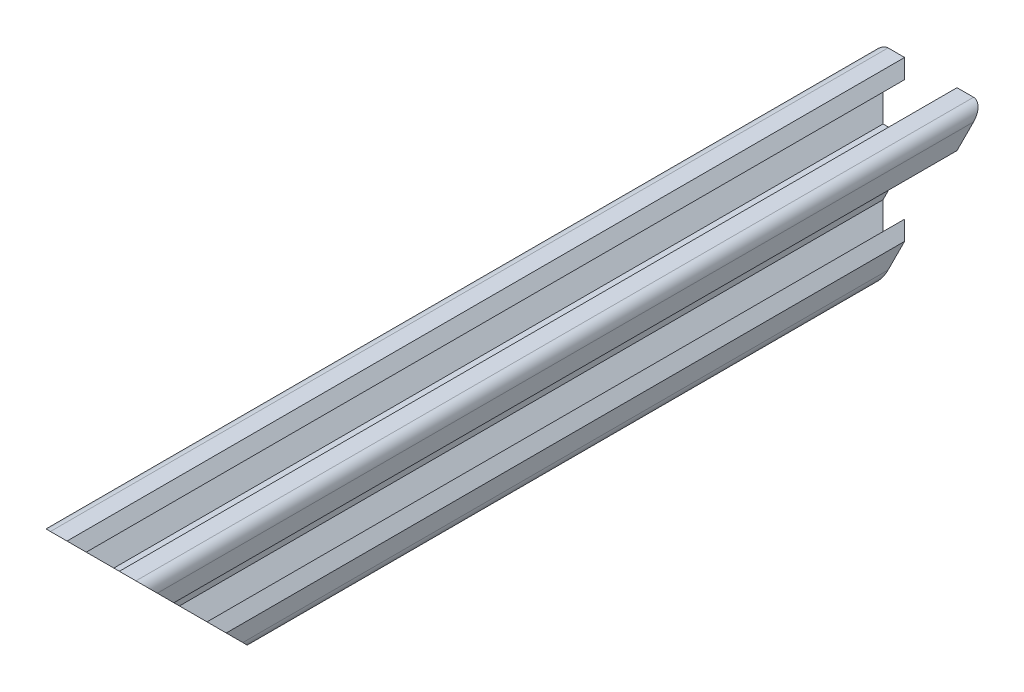
from build123d import *

# Parameters (mm, degrees)
SKETCH1_R           = 2.1
BOSS_EXTRUDE1_DEPTH = 156.74
CUT_EXTRUDE1_DEPTH  = 159.326964223


with BuildPart() as part:
    # Sketch1 → Boss-Extrude1 (new body)
    with BuildSketch(Plane.XY):
        with BuildLine():
            Line((-4.9, -10), (-3.1, -8.2))
            Line((-3.1, -8.2), (-5.5, -8.2))
            Line((-5.5, -8.2), (-5.5, -6.560660172))
            Line((-5.5, -6.560660172), (-2.539339828, -3.6))
            Line((-2.539339828, -3.6), (2.539339828, -3.6))
            Line((2.539339828, -3.6), (5.5, -6.560660172))
            Line((5.5, -6.560660172), (5.5, -8.2))
            Line((5.5, -8.2), (3.1, -8.2))
            Line((3.1, -8.2), (4.9, -10))
            Line((4.9, -10), (8, -10))
            ThreePointArc((8, -10), (9.414213562, -9.414213562), (10, -8))
            Line((10, -8), (10, -4.9))
            Line((10, -4.9), (8.2, -3.1))
            Line((8.2, -3.1), (8.2, -5.5))
            Line((8.2, -5.5), (6.560660172, -5.5))
            Line((6.560660172, -5.5), (3.6, -2.539339828))
            Line((3.6, -2.539339828), (3.6, 2.539339828))
            Line((3.6, 2.539339828), (6.560660172, 5.5))
            Line((6.560660172, 5.5), (8.2, 5.5))
            Line((8.2, 5.5), (8.2, 3.1))
            Line((8.2, 3.1), (10, 4.9))
            Line((10, 4.9), (10, 8))
            ThreePointArc((10, 8), (9.414213562, 9.414213562), (8, 10))
            Line((8, 10), (4.9, 10))
            Line((4.9, 10), (3.1, 8.2))
            Line((3.1, 8.2), (5.5, 8.2))
            Line((5.5, 8.2), (5.5, 6.560660172))
            Line((5.5, 6.560660172), (2.539339828, 3.6))
            Line((2.539339828, 3.6), (-2.539339828, 3.6))
            Line((-2.539339828, 3.6), (-5.5, 6.560660172))
            Line((-5.5, 6.560660172), (-5.5, 8.2))
            Line((-5.5, 8.2), (-3.1, 8.2))
            Line((-3.1, 8.2), (-4.9, 10))
            Line((-4.9, 10), (-8, 10))
            ThreePointArc((-8, 10), (-9.414213562, 9.414213562), (-10, 8))
            Line((-10, 8), (-10, 4.9))
            Line((-10, 4.9), (-8.2, 3.1))
            Line((-8.2, 3.1), (-8.2, 5.5))
            Line((-8.2, 5.5), (-6.560660172, 5.5))
            Line((-6.560660172, 5.5), (-3.6, 2.539339828))
            Line((-3.6, 2.539339828), (-3.6, -2.539339828))
            Line((-3.6, -2.539339828), (-6.560660172, -5.5))
            Line((-6.560660172, -5.5), (-8.2, -5.5))
            Line((-8.2, -5.5), (-8.2, -3.1))
            Line((-8.2, -3.1), (-10, -4.9))
            Line((-10, -4.9), (-10, -8))
            ThreePointArc((-10, -8), (-9.414213562, -9.414213562), (-8, -10))
            Line((-8, -10), (-4.9, -10))
        make_face()
        Circle(SKETCH1_R, mode=Mode.SUBTRACT)
    extrude(amount=BOSS_EXTRUDE1_DEPTH)

    # Sketch2 → Cut-Extrude1 (cut, through all)
    with BuildSketch(Plane(origin=(10, 0, 0), x_dir=(0, 0, -1), z_dir=(1, 0, 0))):
        Polygon((-156.74, 10), (-136.74, -10), (-156.74, -10), align=None)
        Polygon((0, 10), (-20, -10), (0, -10), align=None)
    extrude(amount=-CUT_EXTRUDE1_DEPTH, mode=Mode.SUBTRACT)


solid = part.part
